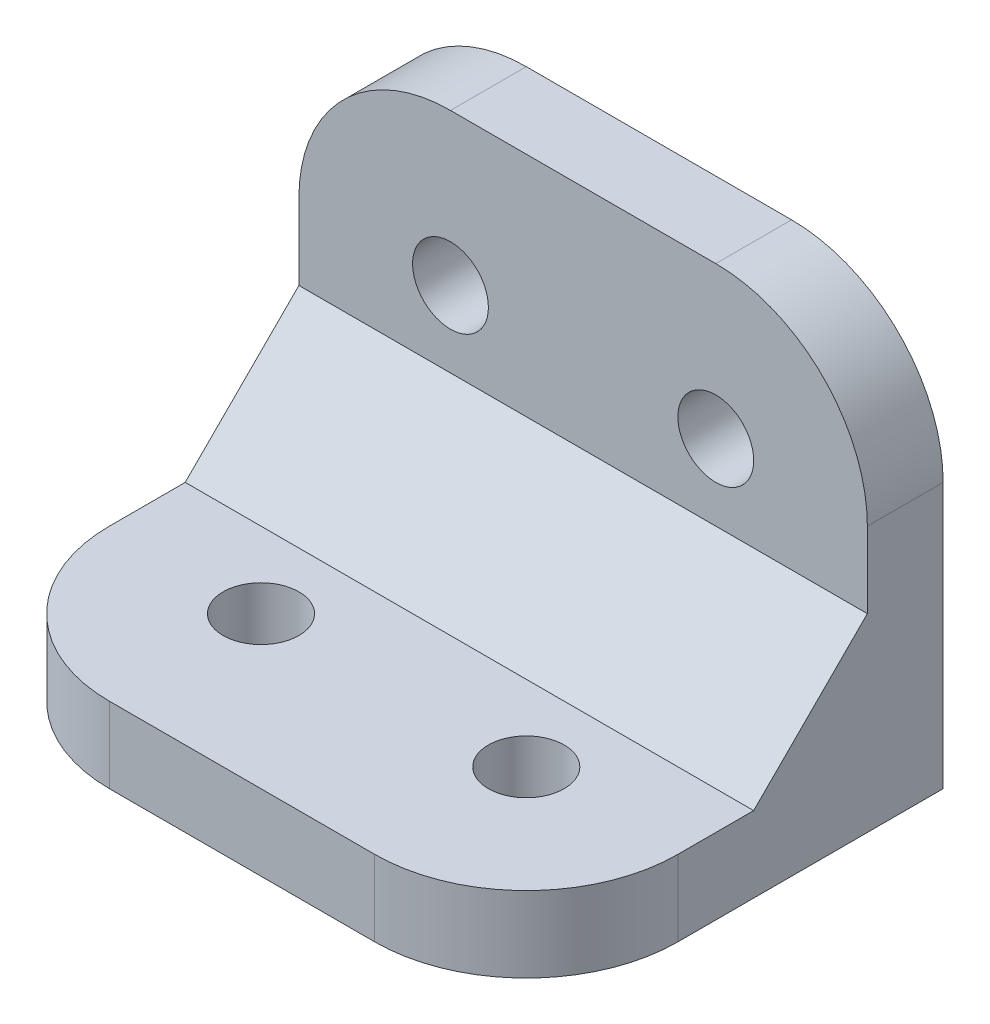
from build123d import *

# Parameters (mm, degrees)
SKETCH_1_W          = 30
SKETCH_1_H          = 22
EXTRUDE_1_DEPTH     = 4
SKETCH_2_W          = 30
SKETCH_2_H          = 4
EXTRUDE_2_DEPTH     = 18
SKETCH_3_R          = 2
CUT_EXTRUDE_1_DEPTH = 20
SKETCH_4_R          = 2
CUT_EXTRUDE_2_DEPTH = 20
CHAMFER_1_SIZE      = 6
FILLET_1_R          = 8


with BuildPart() as part:
    # 草图1 → 凸台-拉伸1 (new body)
    with BuildSketch(Plane(origin=(0, 0, 0), x_dir=(1, 0, 0), z_dir=(0, 1, 0))):
        with Locations((15, -11)):
            Rectangle(SKETCH_1_W, SKETCH_1_H)
    extrude(amount=EXTRUDE_1_DEPTH)

    # 草图2 → 凸台-拉伸2 (add)
    with BuildSketch(Plane(origin=(0, 4, 0), x_dir=(1, 0, 0), z_dir=(0, 1, 0))):
        with Locations((15, -2)):
            Rectangle(SKETCH_2_W, SKETCH_2_H)
    extrude(amount=EXTRUDE_2_DEPTH)

    # 草图3 → 切除-拉伸1 (cut)
    with BuildSketch(Plane(origin=(0, 4, 0), x_dir=(1, 0, 0), z_dir=(0, 1, 0))):
        with Locations(Location((8, -14, 0), (0, 0, 270))):
            Circle(SKETCH_3_R)
        with Locations(Location((22, -14, 0), (0, 0, 270))):
            Circle(SKETCH_3_R)
    extrude(amount=-CUT_EXTRUDE_1_DEPTH, mode=Mode.SUBTRACT)

    # 草图4 → 切除-拉伸2 (cut)
    with BuildSketch(Plane.XY.offset(4)):
        with Locations((8, 14)):
            Circle(SKETCH_4_R)
        with Locations((22, 14)):
            Circle(SKETCH_4_R)
    extrude(amount=-CUT_EXTRUDE_2_DEPTH, mode=Mode.SUBTRACT)

    # 倒角1
    chamfer_1_edges = [part.edges().sort_by_distance(p)[0] for p in [
        (15, 4, 4),
    ]]
    chamfer(chamfer_1_edges, length=CHAMFER_1_SIZE)

    # 圆角1
    fillet_1_edges = [part.edges().sort_by_distance(p)[0] for p in [
        (0, 22, 2),
        (30, 22, 2),
        (30, 2, 22),
        (0, 2, 22),
    ]]
    fillet(fillet_1_edges, radius=FILLET_1_R)


solid = part.part
